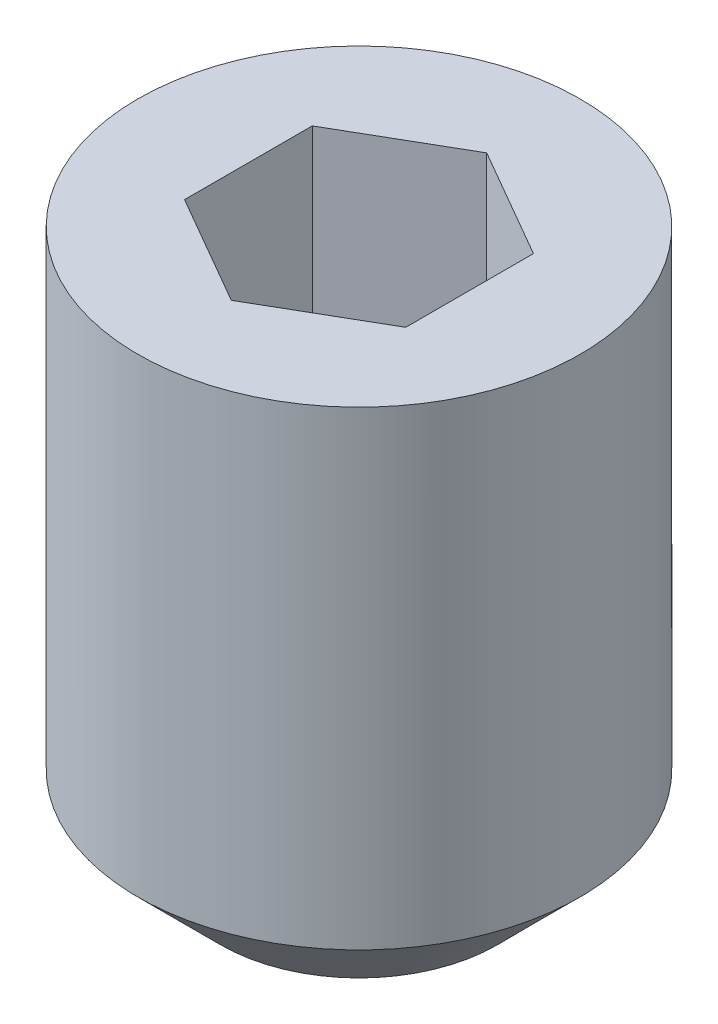
from build123d import *

# Parameters (mm, degrees)
SKETCH1_W          = 2
SKETCH1_H          = 5
CUT_EXTRUDE1_DEPTH = 1.5


with BuildPart() as part:
    # Sketch1 → Revolve1 (revolve)
    with BuildSketch(Plane.XY, mode=Mode.PRIVATE) as revolve1_sk:
        with Locations((1, 2.5)):
            Rectangle(SKETCH1_W, SKETCH1_H)
    revolve(revolve1_sk.sketch.rotate(Axis((0, 5, 0), (0, -1, 0)), 180), axis=Axis((0, 5, 0), (0, -1, 0)))

    # Sketch2 → Cut-Revolve1 (revolve, cut)
    with BuildSketch(Plane.XY, mode=Mode.PRIVATE) as cut_revolve1_sk:
        Polygon((0, 5), (1, 5), (1, 3.5), (0, 2.922649731), align=None)
    revolve(cut_revolve1_sk.sketch.rotate(Axis((0, 5, 0), (0, -1, 0)), 180), axis=Axis((0, 5, 0), (0, -1, 0)), mode=Mode.SUBTRACT)

    # Sketch3 → Cut-Extrude1 (cut)
    with BuildSketch(Plane(origin=(0, 5, 0), x_dir=(1, 0, 0), z_dir=(0, 1, 0))):
        Polygon((0, 1.154700538), (-1, 0.577350269), (-1, -0.577350269), (0, -1.154700538), (1, -0.577350269), (1, 0.577350269), align=None)
    extrude(amount=-CUT_EXTRUDE1_DEPTH, mode=Mode.SUBTRACT)

    # Sketch4 → Cut-Revolve2 (revolve, cut)
    with BuildSketch(Plane.XY, mode=Mode.PRIVATE) as cut_revolve2_sk:
        Polygon((1.25, 0), (2, 0), (2, 0.75), align=None)
    revolve(cut_revolve2_sk.sketch.rotate(Axis((0, 0, 0), (0, 1, 0)), 180), axis=Axis((0, 0, 0), (0, 1, 0)), mode=Mode.SUBTRACT)


solid = part.part
